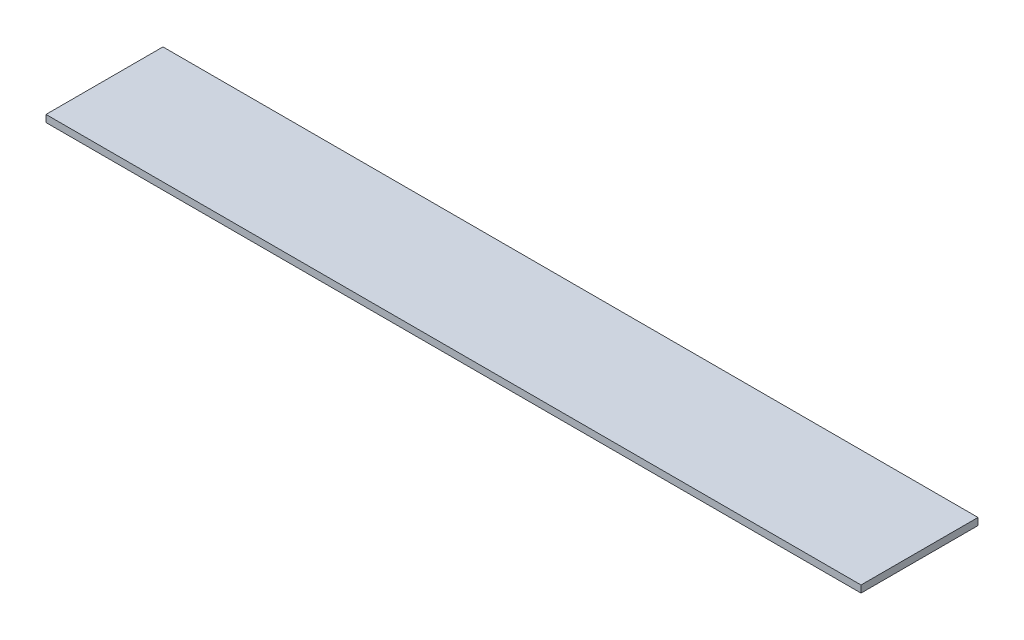
from build123d import *

# Parameters (mm, degrees)
SKETCH1_W           = 1371.6
SKETCH1_H           = 196.85
BOSS_EXTRUDE1_DEPTH = 11.8872


with BuildPart() as part:
    # Sketch1 → Boss-Extrude1 (new body)
    with BuildSketch(Plane(origin=(0, 0, 0), x_dir=(1, 0, 0), z_dir=(0, 1, 0))):
        Rectangle(SKETCH1_W, SKETCH1_H)
    extrude(amount=BOSS_EXTRUDE1_DEPTH)


solid = part.part
